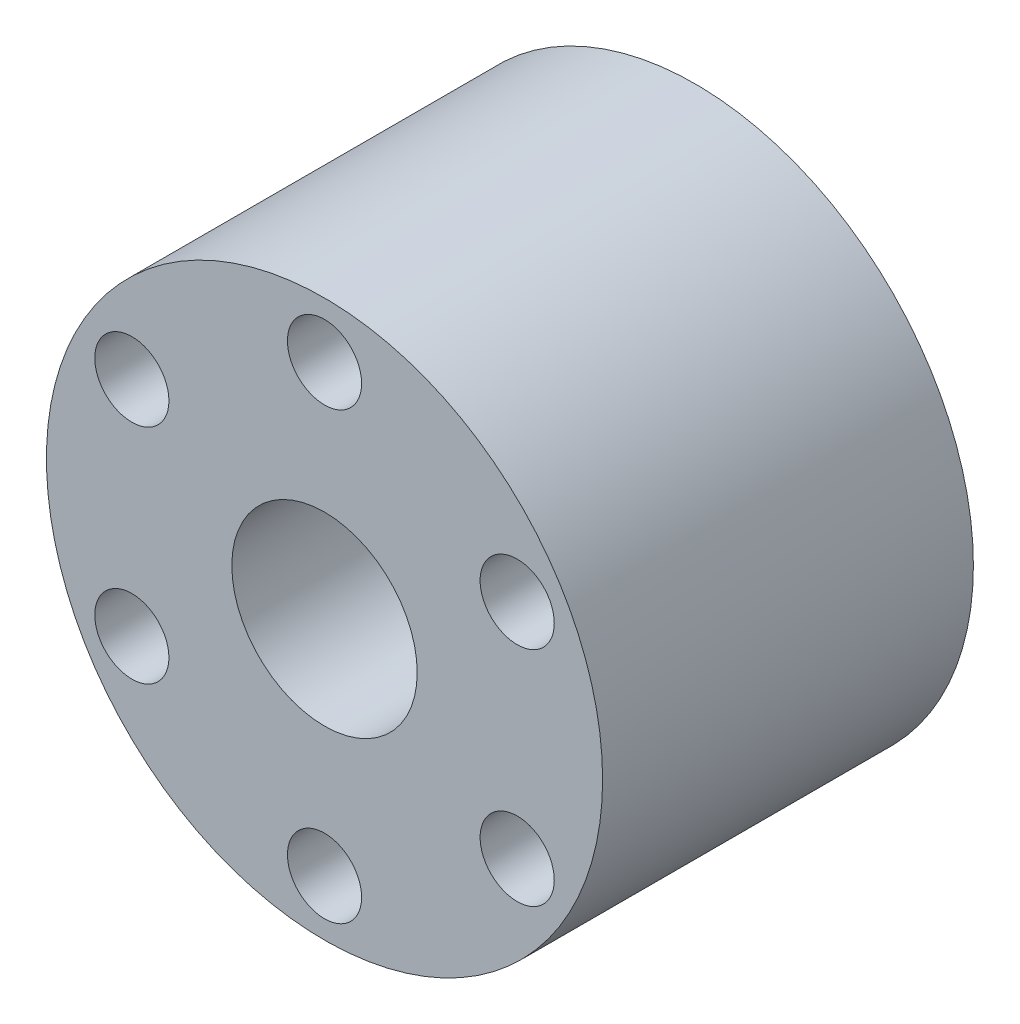
from build123d import *

# Parameters (mm, degrees)
SKETCH1_R           = 15
BOSS_EXTRUDE1_DEPTH = 20
SKETCH2_R           = 5
SKETCH2_R_2         = 2
CUT_EXTRUDE1_DEPTH  = 30.154759474


with BuildPart() as part:
    # Sketch1 → Boss-Extrude1 (new body)
    with BuildSketch(Plane.XY):
        Circle(SKETCH1_R)
    extrude(amount=BOSS_EXTRUDE1_DEPTH)

    # Sketch2 → Cut-Extrude1 (cut, through all)
    with BuildSketch(Plane.XY.offset(20)):
        Circle(SKETCH2_R)
        with Locations((0, 12)):
            Circle(SKETCH2_R_2)
        with Locations((10.392304845, 6)):
            Circle(SKETCH2_R_2)
        with Locations((10.392304845, -6)):
            Circle(SKETCH2_R_2)
        with Locations((0, -12)):
            Circle(SKETCH2_R_2)
        with Locations((-10.392304845, -6)):
            Circle(SKETCH2_R_2)
        with Locations((-10.392304845, 6)):
            Circle(SKETCH2_R_2)
    extrude(amount=-CUT_EXTRUDE1_DEPTH, mode=Mode.SUBTRACT)


solid = part.part
